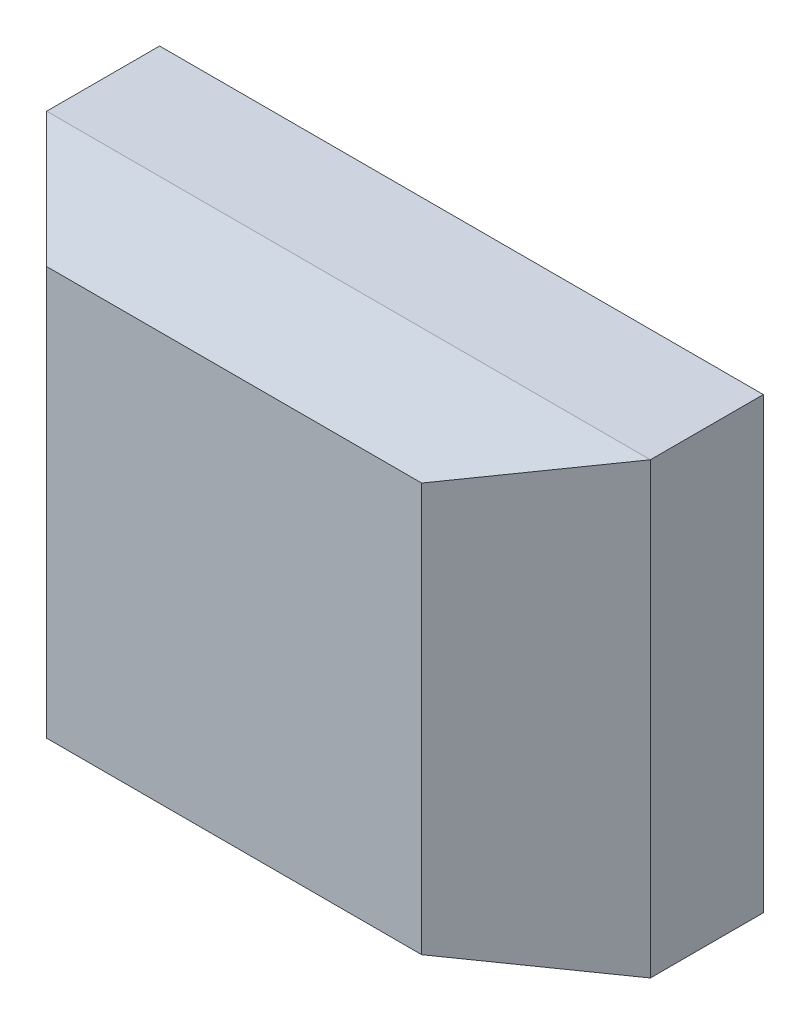
from build123d import *

# Parameters (mm, degrees)
BOSS_EXTRUDE1_DEPTH = 3.1
CUT_EXTRUDE1_DEPTH  = 6.428056743


with BuildPart() as part:
    # Sketch2 → Boss-Extrude1 (new body)
    with BuildSketch(Plane(origin=(0, 0, 0), x_dir=(1, 0, 0), z_dir=(0, 1, 0))):
        Polygon((-2.085, 0), (2.085, 0), (2.085, -0.78), (1.295, -1.57), (-1.295, -1.57), (-2.085, -0.78), align=None)
    extrude(amount=-BOSS_EXTRUDE1_DEPTH)

    # Sketch4 → Cut-Extrude1 (cut, through all)
    with BuildSketch(Plane(origin=(2.085, 0, 0), x_dir=(0, 0, -1), z_dir=(1, 0, 0))):
        Polygon((-0.78, 0), (-2.734960496, -0.344712282), (-2.734960496, 0), align=None)
        Polygon((-0.78, -3.1), (-2.582357752, -2.782195699), (-2.582357752, -3.1), align=None)
    extrude(amount=-CUT_EXTRUDE1_DEPTH, mode=Mode.SUBTRACT)


solid = part.part
